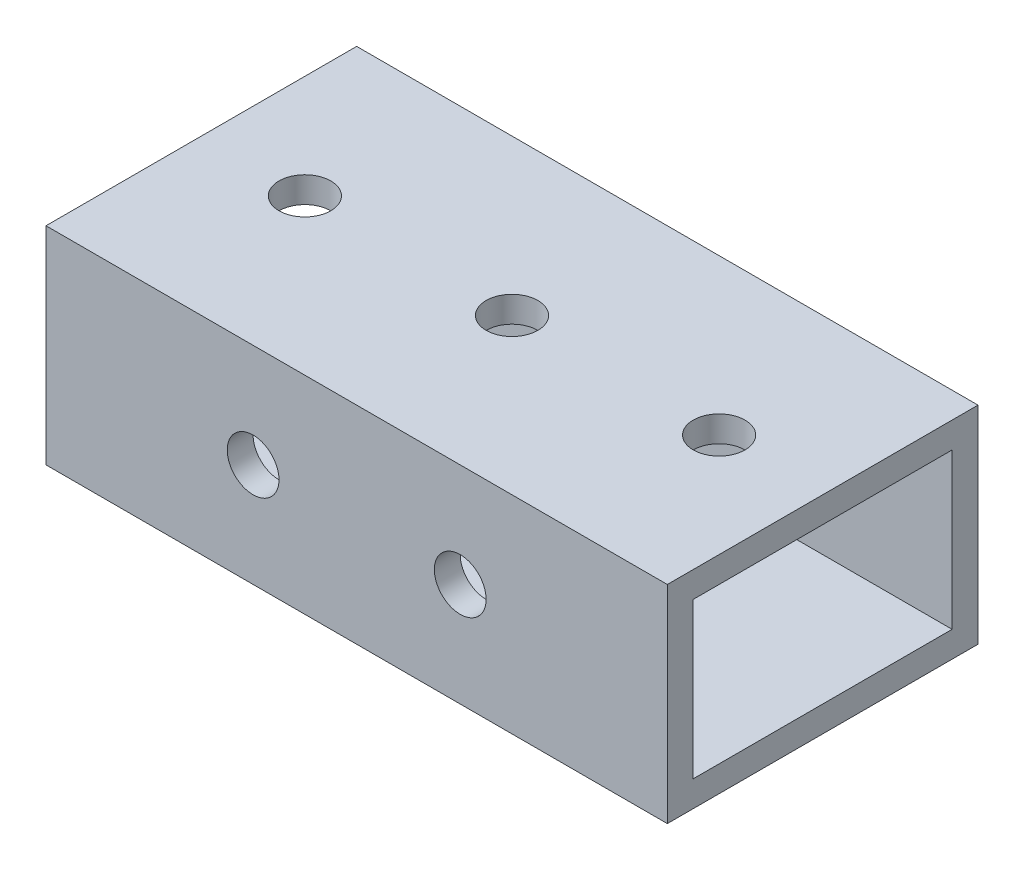
from build123d import *

# Parameters (mm, degrees)
SKETCH1_W           = 76.2
SKETCH1_H           = 38.1
BOSS_EXTRUDE1_DEPTH = 25.4
SKETCH2_W           = 31.75
SKETCH2_H           = 19.05
CUT_EXTRUDE1_DEPTH  = 127
SKETCH3_R           = 3.175
CUT_EXTRUDE2_DEPTH  = 3.175
SKETCH4_R           = 3.175
CUT_EXTRUDE4_DEPTH  = 3.175
SKETCH3_5_R         = 3.175
CUT_EXTRUDE5_DEPTH  = 3.175


with BuildPart() as part:
    # Sketch1 → Boss-Extrude1 (new body)
    with BuildSketch(Plane(origin=(0, 0, 0), x_dir=(1, 0, 0), z_dir=(0, 1, 0))):
        Rectangle(SKETCH1_W, SKETCH1_H)
    extrude(amount=BOSS_EXTRUDE1_DEPTH)

    # Sketch2 → Cut-Extrude1 (cut)
    with BuildSketch(Plane(origin=(38.1, 0, 0), x_dir=(0, 0, -1), z_dir=(1, 0, 0))):
        with Locations((0, 12.7)):
            Rectangle(SKETCH2_W, SKETCH2_H)
    extrude(amount=-CUT_EXTRUDE1_DEPTH, mode=Mode.SUBTRACT)

    # Sketch3 → Cut-Extrude2 (cut)
    with BuildSketch(Plane(origin=(0, 25.4, 0), x_dir=(1, 0, 0), z_dir=(0, 1, 0))):
        with Locations((-25.4, 0)):
            Circle(SKETCH3_R)
        Circle(SKETCH3_R)
    cut_extrude2 = extrude(amount=-CUT_EXTRUDE2_DEPTH, mode=Mode.SUBTRACT)

    # Mirror1: Cut-Extrude2 across plane
    add(cut_extrude2.mirror(Plane.ZX.offset(12.7)), mode=Mode.SUBTRACT)

    # Sketch4 → Cut-Extrude4 (cut)
    with BuildSketch(Plane.XY.offset(19.05)):
        with Locations((-12.7, 12.7)):
            Circle(SKETCH4_R)
        with Locations((12.7, 12.7)):
            Circle(SKETCH4_R)
    cut_extrude4 = extrude(amount=-CUT_EXTRUDE4_DEPTH, mode=Mode.SUBTRACT)

    # Mirror3: Cut-Extrude4 across plane
    add(cut_extrude4.mirror(Plane.XY), mode=Mode.SUBTRACT)

    # Sketch3<5> → Cut-Extrude5 (cut)
    with BuildSketch(Plane(origin=(0, 25.4, 0), x_dir=(1, 0, 0), z_dir=(0, 1, 0))):
        with Locations((25.4, 0)):
            Circle(SKETCH3_5_R)
    extrude(amount=-CUT_EXTRUDE5_DEPTH, mode=Mode.SUBTRACT)


solid = part.part
